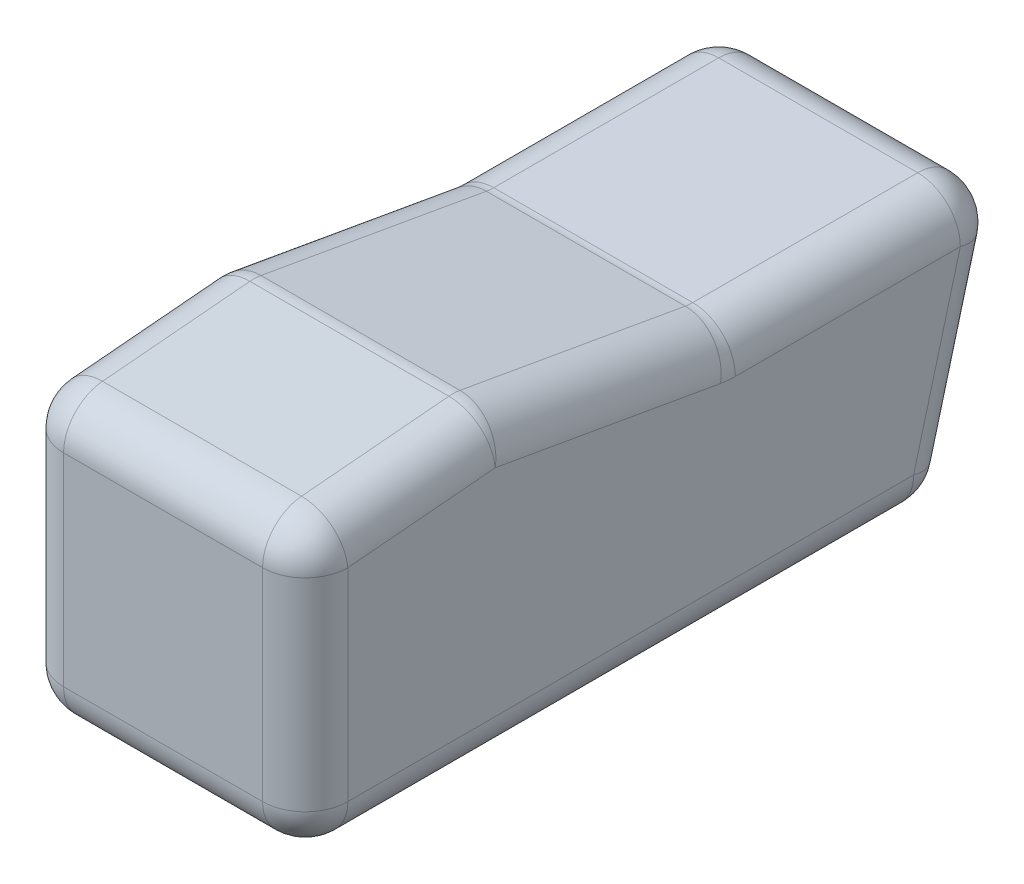
from build123d import *

# Parameters (mm, degrees)
AUFSATZ_LINEAR_AUSTRAGEN1_DEPTH      = 1000
AUFSATZ_LINEAR_AUSTRAGEN1_DEPTH_BACK = 1000
VERRUNDUNG1_R                        = 300


with BuildPart() as part:
    # Skizze2 → Aufsatz-Linear austragen1 (new, two sides: drawn at the far end of the back side and taken through both)
    with BuildSketch(Plane(origin=(0, 0, 0), x_dir=(0, 0, -1), z_dir=(1, 0, 0)).offset(-AUFSATZ_LINEAR_AUSTRAGEN1_DEPTH_BACK)):
        Polygon((500, -1000), (500, 1000), (1850, 1118.10969576), (3500, 827.170177591), (5500, 827.170177591), (5010.41122648, -1000), align=None)
    extrude(amount=AUFSATZ_LINEAR_AUSTRAGEN1_DEPTH + AUFSATZ_LINEAR_AUSTRAGEN1_DEPTH_BACK)

    # Verrundung1
    verrundung1_edges = [part.edges().sort_by_distance(p)[0] for p in [
        (-1000, 827.170177591, -4500),
        (0, 827.170177591, -5500),
        (1000, 827.170177591, -4500),
        (-1000, 972.639936676, -2675),
        (0, 827.170177591, -3500),
        (1000, 972.639936676, -2675),
        (-1000, 1059.05484788, -1175),
        (0, 1118.10969576, -1850),
        (1000, 1059.05484788, -1175),
        (0, 1000, -500),
        (0, -1000, -500),
        (-1000, 0, -500),
        (-1000, -1000, -2755.20561324),
        (-1000, -86.414911204, -5255.20561324),
        (0, -1000, -5010.41122648),
        (1000, -86.414911204, -5255.20561324),
        (1000, -1000, -2755.20561324),
        (1000, 0, -500),
    ]]
    fillet(verrundung1_edges, radius=VERRUNDUNG1_R)


solid = part.part
